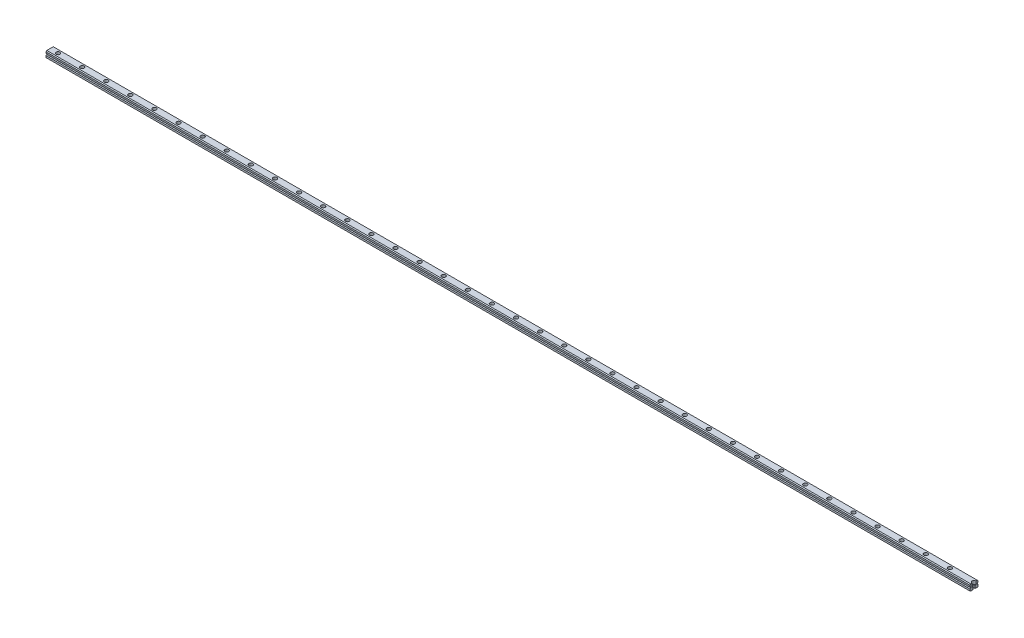
from build123d import *

# Parameters (mm, degrees)
BOSS_EXTRUDE1_DEPTH = 2300
SKETCH2_R           = 4.75
CUT_EXTRUDE1_DEPTH  = 8.5
SKETCH3_R           = 3
CUT_EXTRUDE2_DEPTH  = 2301.037445347
LPATTERN1_COUNT     = 40
LPATTERN1_PITCH     = 60


with BuildPart() as part:
    # Sketch1 → Boss-Extrude1 (new body)
    with BuildSketch(Plane(origin=(0, 0, 0), x_dir=(0, 0, -1), z_dir=(1, 0, 0))):
        Polygon((9, 0), (-9, 0), (-10, 1), (-10, 5.5), (-8, 7), (-8, 8.5), (-10, 10.5), (-10, 13.5), (-8, 15.5), (8, 15.5), (10, 13.5), (10, 10.5), (8, 8.5), (8, 7), (10, 5.5), (10, 1), align=None)
    extrude(amount=BOSS_EXTRUDE1_DEPTH)

    # Sketch2 → Cut-Extrude1 (cut)
    with BuildSketch(Plane(origin=(0, 15.5, 0), x_dir=(1, 0, 0), z_dir=(0, 1, 0))):
        with Locations(Location((20, 0, 0), (0, 0, 270))):
            Circle(SKETCH2_R)
    cut_extrude1 = extrude(amount=-CUT_EXTRUDE1_DEPTH, mode=Mode.SUBTRACT)

    # Sketch3 → Cut-Extrude2 (cut, through all)
    with BuildSketch(Plane(origin=(0, 7, 0), x_dir=(1, 0, 0), z_dir=(0, 1, 0))):
        with Locations(Location((20, 0, 0), (0, 0, 270))):
            Circle(SKETCH3_R)
    cut_extrude2 = extrude(amount=-CUT_EXTRUDE2_DEPTH, mode=Mode.SUBTRACT)

    # LPattern1: Cut-Extrude1, Cut-Extrude2 ×40
    with Locations(*[(i * LPATTERN1_PITCH, 0, 0) for i in range(1, LPATTERN1_COUNT)]):
        add(cut_extrude1, mode=Mode.SUBTRACT)
        add(cut_extrude2, mode=Mode.SUBTRACT)


solid = part.part
